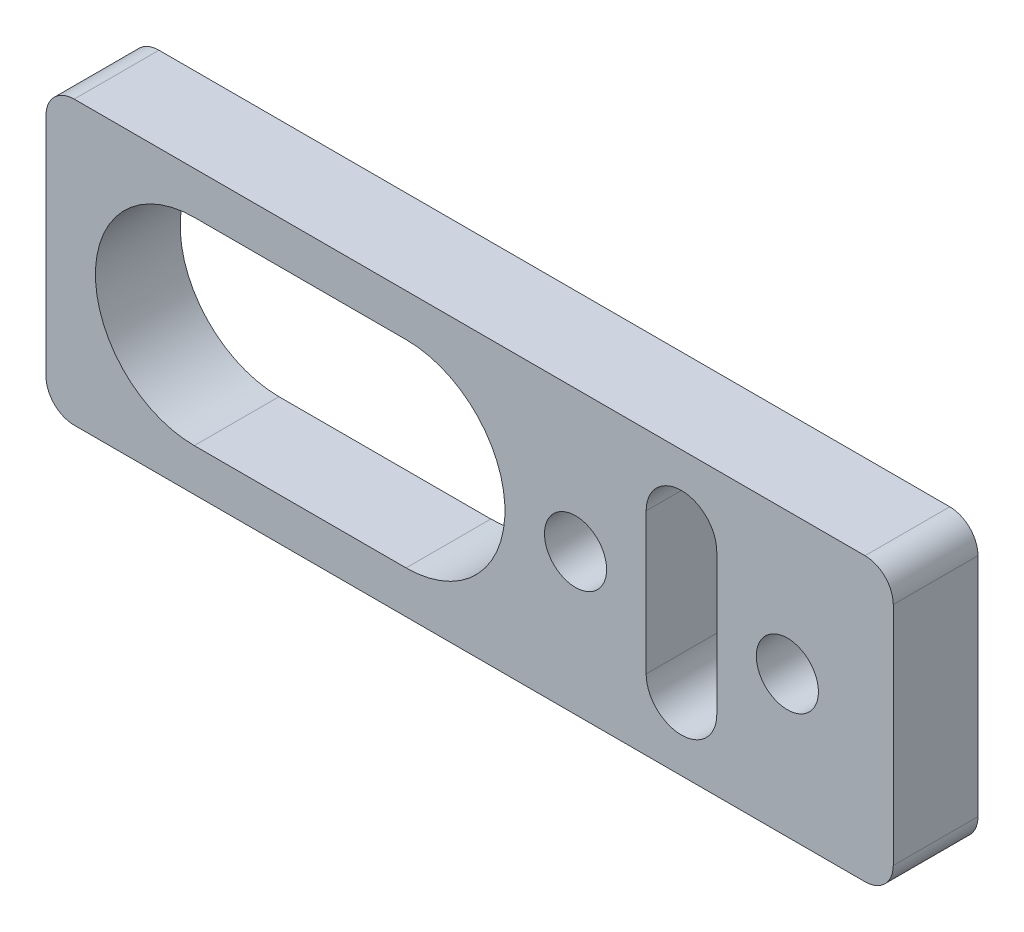
from build123d import *

# Parameters (mm, degrees)
SKETCH_1_W          = 60
SKETCH_1_H          = 20
EXTRUDE_1_DEPTH     = 6
FILLET_1_R          = 2
SKETCH_2_R          = 2.2
CUT_EXTRUDE_1_DEPTH = 33.186953879
CUT_EXTRUDE_2_DEPTH = 33.186953879


with BuildPart() as part:
    # 草图1 → 凸台-拉伸1 (new body)
    with BuildSketch(Plane.XY):
        Rectangle(SKETCH_1_W, SKETCH_1_H)
    extrude(amount=EXTRUDE_1_DEPTH)

    # 圆角1
    fillet_1_edges = [part.edges().sort_by_distance(p)[0] for p in [
        (30, -10, 3),
        (-30, -10, 3),
        (-30, 10, 3),
        (30, 10, 3),
    ]]
    fillet(fillet_1_edges, radius=FILLET_1_R)

    # 草图2 → 切除-拉伸1 (cut, through all)
    with BuildSketch(Plane.XY.offset(6)):
        with Locations((22.5, 0)):
            Circle(SKETCH_2_R)
        with Locations((7.5, 0)):
            Circle(SKETCH_2_R)
    extrude(amount=-CUT_EXTRUDE_1_DEPTH, mode=Mode.SUBTRACT)

    # 草图3 → 切除-拉伸2 (cut, through all)
    with BuildSketch(Plane.XY.offset(6)):
        with BuildLine():
            Line((-19.5, 7), (-4.5, 7))
            ThreePointArc((-4.5, 7), (2.5, 0), (-4.5, -7))
            Line((-4.5, -7), (-19.5, -7))
            ThreePointArc((-19.5, -7), (-26.5, 0), (-19.5, 7))
        make_face()
        with BuildLine():
            Line((12.5, -5), (12.5, 5))
            ThreePointArc((12.5, 5), (15, 7.5), (17.5, 5))
            Line((17.5, 5), (17.5, -5))
            ThreePointArc((17.5, -5), (15, -7.5), (12.5, -5))
        make_face()
    extrude(amount=-CUT_EXTRUDE_2_DEPTH, mode=Mode.SUBTRACT)


solid = part.part
